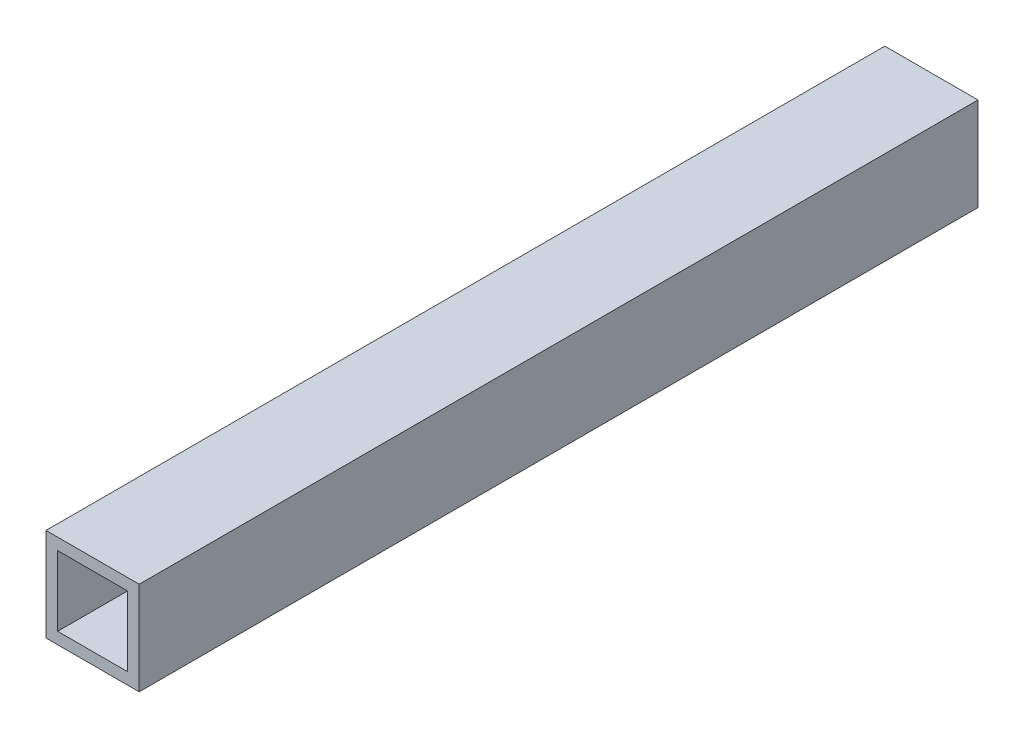
from build123d import *

# Parameters (mm, degrees)
SKETCH2_W           = 25.4
SKETCH2_H           = 25.4
SKETCH2_W_2         = 19.05
SKETCH2_H_2         = 19.05
BOSS_EXTRUDE1_DEPTH = 228.6


with BuildPart() as part:
    # Sketch2 → Boss-Extrude1 (new body)
    with BuildSketch(Plane.XY):
        with Locations((-82.191315181, 6.9723118)):
            Rectangle(SKETCH2_W, SKETCH2_H)
        with Locations((-82.191315181, 6.9723118)):
            Rectangle(SKETCH2_W_2, SKETCH2_H_2, mode=Mode.SUBTRACT)
    extrude(amount=BOSS_EXTRUDE1_DEPTH)


solid = part.part
